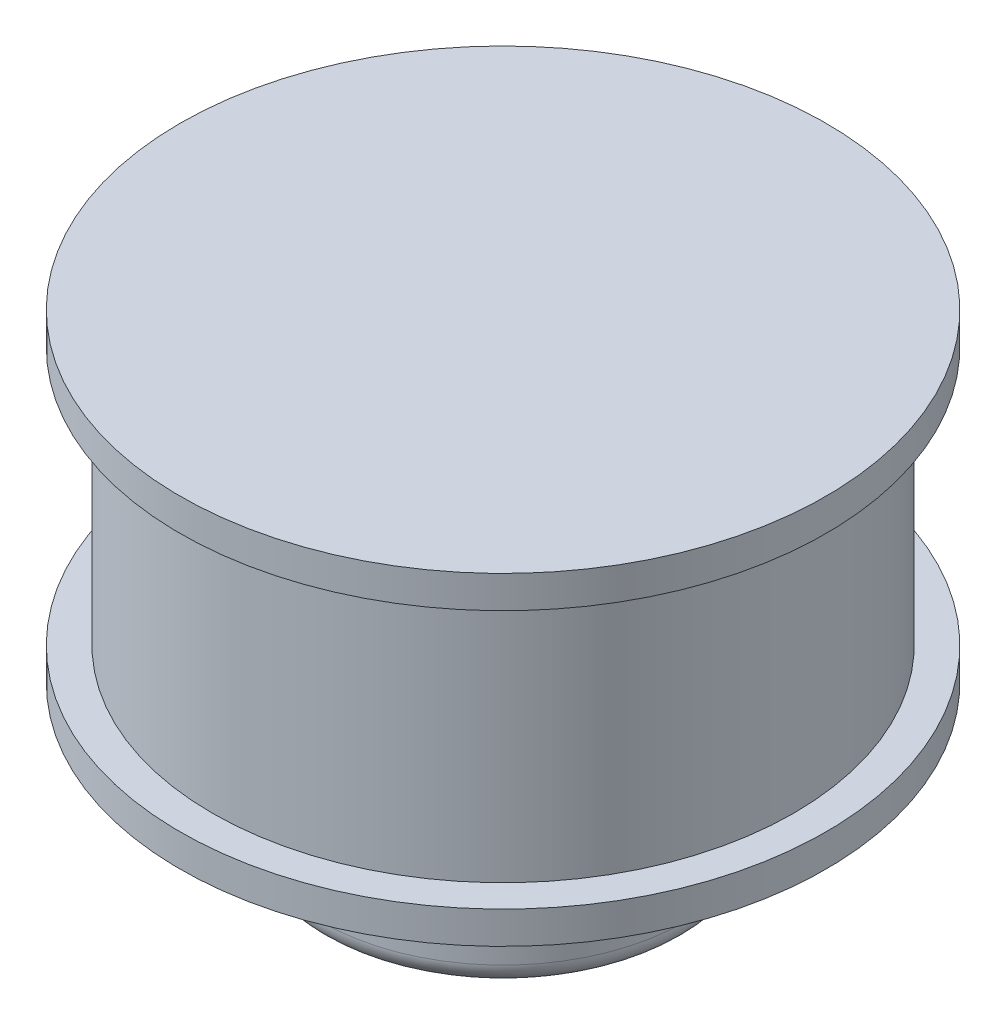
from build123d import *

# Parameters (mm, degrees)
FILLET1_R = 1
SKETCH3_W = 1.25
SKETCH3_H = 8.5


with BuildPart() as part:
    # Sketch1 → Revolve1 (revolve)
    with BuildSketch(Plane.XY):
        Polygon((-8.5, -6.35), (-8.5, 0), (-15, 0), (-15, 1.5), (-13.5, 1.5), (-13.5, 13.5), (-15, 13.5), (-15, 15), (0, 15), (0, 7.65), (-4, 7.65), (-4, -6.35), align=None)
    revolve(axis=Axis((0, 15, 0), (0, -1, 0)))

    # Fillet1
    fillet1_edges = [part.edges().sort_by_distance(p)[0] for p in [
        (8.5, -6.35, 0),
        (4, -6.35, 0),
    ]]
    fillet(fillet1_edges, radius=FILLET1_R)

    # Sketch3 → M3x0.5 Tapped Hole1 (revolve, cut)
    with BuildSketch(Plane(origin=(0, -2.35, 0), x_dir=(0, 1, 0), z_dir=(1, 0, 0))):
        with Locations((0.625, 4.25)):
            Rectangle(SKETCH3_W, SKETCH3_H)
    revolve(axis=Axis((0, -2.35, -6.35), (0, 0, 1)), mode=Mode.SUBTRACT)


solid = part.part
